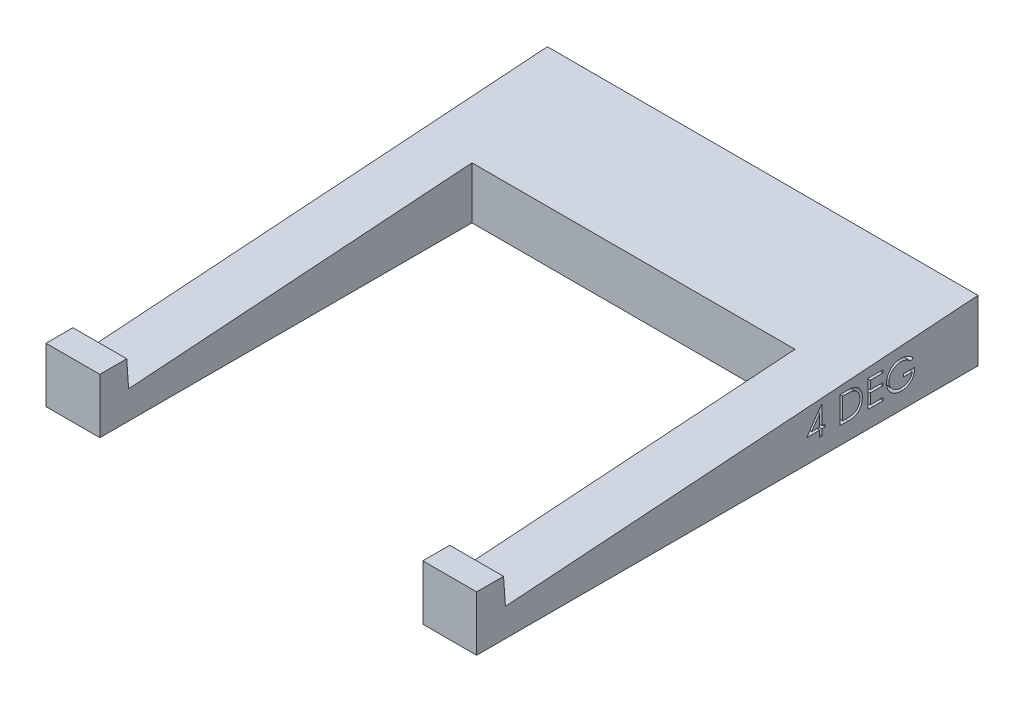
from build123d import *

# Parameters (mm, degrees)
BOSS_EXTRUDE1_DEPTH = 50.8
SKETCH5_W           = 38.1
SKETCH5_H           = 43.900896756
CUT_EXTRUDE2_DEPTH  = 74.010756427
CUT_EXTRUDE4_DEPTH  = 2.54


with BuildPart() as part:
    # Sketch1 → Boss-Extrude1 (new body)
    with BuildSketch(Plane(origin=(0, 0, 0), x_dir=(0, 0, -1), z_dir=(1, 0, 0))):
        Polygon((11.9888, 15.748), (11.9888, 22.947991753), (6.921174625, 22.593628866), (-43.755079129, 19.05), (-43.977096756, 22.225), (-47.152096756, 22.225), (-47.152096756, 15.748), align=None)
    extrude(amount=BOSS_EXTRUDE1_DEPTH)

    # Sketch5 → Cut-Extrude2 (cut, through all)
    with BuildSketch(Plane(origin=(0, 0, 0), x_dir=(1, 0, 0), z_dir=(0, 1, 0))):
        with Locations((25.4, -25.201648378)):
            Rectangle(SKETCH5_W, SKETCH5_H)
    extrude(amount=CUT_EXTRUDE2_DEPTH, mode=Mode.SUBTRACT)

    # Sketch7 → Cut-Extrude4 (cut)
    # profile 1 of 4: a face of its own
    with BuildSketch(Plane(origin=(50.8, 0, 0), x_dir=(0, 0, -1), z_dir=(1, 0, 0))):
        Polygon((-6.475936579, 21.036410256), (-6.418058974, 21.036410256), (-6.418058974, 18.838333333), (-6.051712821, 18.838333333), (-6.051712821, 18.512692308), (-6.418058974, 18.512692308), (-6.418058974, 17.78), (-6.702994872, 17.78), (-6.702994872, 18.512692308), (-8.209084615, 18.512692308), align=None)
        Polygon((-6.702994872, 18.838333333), (-6.702994872, 20.217219551), (-7.649389103, 18.838333333), align=None, mode=Mode.SUBTRACT)
    # profile 2 of 4: a face of its own
    with BuildSketch(Plane(origin=(50.8, 0, 0), x_dir=(0, 0, -1), z_dir=(1, 0, 0))):
        with BuildLine():
            Line((-4.260687179, 17.78), (-4.260687179, 20.955))
            Line((-4.260687179, 20.955), (-3.61958141, 20.955))
            add(Edge.make_bspline(
                [(-3.61958141, 20.955), (-3.563820257, 20.954598526), (-3.456089998, 20.95382288), (-3.300412992, 20.948904903), (-3.156373436, 20.940204981), (-3.024445057, 20.927532625), (-2.904265672, 20.911972373), (-2.796171792, 20.892468435), (-2.699604491, 20.869437737), (-2.640214355, 20.849802222), (-2.612129487, 20.840516827)],
                knots=[0, 0, 0, 0, 1.314313732, 2.53924729, 3.670748893, 4.714932338, 5.66265055, 6.526160246, 7.303039223, 8, 8, 8, 8], degree=3))
            add(Edge.make_bspline(
                [(-2.612129487, 20.840516827), (-2.575394974, 20.826518973), (-2.502758964, 20.798840689), (-2.399338217, 20.746628901), (-2.30197878, 20.687471302), (-2.210158556, 20.621289912), (-2.125974949, 20.546210824), (-2.046139214, 20.465423325), (-1.973917286, 20.375989617), (-1.907779046, 20.279764449), (-1.848147412, 20.177881373), (-1.796314033, 20.070534524), (-1.753266482, 19.958269057), (-1.717531198, 19.841397173), (-1.689367626, 19.719661887), (-1.670152588, 19.592921452), (-1.657478904, 19.461676758), (-1.656205229, 19.372618495), (-1.655558974, 19.327430889)],
                knots=[0, 0, 0, 0, 0.984719456, 1.947108742, 2.898477687, 3.838006223, 4.779231079, 5.722358779, 6.681677486, 7.655904652, 8.64651281, 9.637519902, 10.640069247, 11.656948941, 12.698408672, 13.768548281, 14.867775369, 16, 16, 16, 16], degree=3))
            add(Edge.make_bspline(
                [(-1.655558974, 19.327430889), (-1.656129538, 19.288186766), (-1.657253892, 19.210852122), (-1.667349772, 19.096877881), (-1.682024005, 18.986284855), (-1.70474267, 18.879599684), (-1.732322093, 18.775887658), (-1.767668145, 18.676254122), (-1.808158916, 18.579785095), (-1.855375592, 18.487784956), (-1.907210991, 18.400623612), (-1.962838572, 18.318458668), (-2.022199003, 18.242462574), (-2.085858327, 18.17240519), (-2.152993899, 18.10839213), (-2.224045256, 18.049888659), (-2.299195737, 17.998039498), (-2.37810875, 17.950807193), (-2.463086382, 17.909604442), (-2.555738203, 17.874742933), (-2.656459343, 17.845853503), (-2.765002575, 17.821749905), (-2.881555445, 17.802629781), (-3.006232221, 17.789815125), (-3.138841348, 17.78114925), (-3.229899681, 17.780390522), (-3.276767909, 17.78)],
                knots=[0, 0, 0, 0, 1.105936401, 2.179363191, 3.223086493, 4.248585256, 5.251745608, 6.245858792, 7.225916811, 8.198733463, 9.158002045, 10.082870192, 10.993790845, 11.873723703, 12.748670949, 13.606408763, 14.465103618, 15.319838547, 16.196477973, 17.123216899, 18.106603292, 19.147568657, 20.255746949, 21.433717677, 22.679120308, 24, 24, 24, 24], degree=3))
            Line((-3.276767909, 17.78), (-4.260687179, 17.78))
        make_face()
        with BuildLine():
            Line((-3.975751282, 18.105641026), (-3.611313181, 18.105641026))
            add(Edge.make_bspline(
                [(-3.611313181, 18.105641026), (-3.558945302, 18.105866084), (-3.458222692, 18.106298955), (-3.31339008, 18.110097347), (-3.181056628, 18.116303961), (-3.061203544, 18.124989925), (-2.953898501, 18.136482168), (-2.858917242, 18.149295473), (-2.776571115, 18.165258875), (-2.726742268, 18.179728674), (-2.703716026, 18.186415264)],
                knots=[0, 0, 0, 0, 1.375205317, 2.645023457, 3.804390687, 4.853969522, 5.800190428, 6.637939096, 7.370582563, 8, 8, 8, 8], degree=3))
            add(Edge.make_bspline(
                [(-2.703716026, 18.186415264), (-2.674734297, 18.196622035), (-2.617463068, 18.216791788), (-2.535020941, 18.253583381), (-2.45813423, 18.297164401), (-2.385462992, 18.345607892), (-2.318038098, 18.40062248), (-2.255060507, 18.461011877), (-2.196657015, 18.527083423), (-2.143431036, 18.598755112), (-2.095798503, 18.675580856), (-2.054549602, 18.756805369), (-2.01839857, 18.84153869), (-1.990024418, 18.931081998), (-1.967785281, 19.024634787), (-1.952033028, 19.122203637), (-1.942222528, 19.223770329), (-1.941078215, 19.292851184), (-1.940494872, 19.328066907)],
                knots=[0, 0, 0, 0, 0.998632004, 1.973411704, 2.929992603, 3.868527914, 4.809262121, 5.754881198, 6.702106254, 7.672490631, 8.653608572, 9.636854334, 10.631411391, 11.644891563, 12.686317036, 13.754757253, 14.855430412, 16, 16, 16, 16], degree=3))
            add(Edge.make_bspline(
                [(-1.940494872, 19.328066907), (-1.940960497, 19.365199421), (-1.941875221, 19.438146574), (-1.953372631, 19.545180991), (-1.970174328, 19.648124152), (-1.994470958, 19.746982944), (-2.025432541, 19.841950235), (-2.064071966, 19.93250079), (-2.108219542, 20.019590921), (-2.16074614, 20.101210525), (-2.218273143, 20.178402131), (-2.282115933, 20.249118376), (-2.351260211, 20.313520348), (-2.424951824, 20.37261101), (-2.505267622, 20.424013059), (-2.590315612, 20.46999312), (-2.681343471, 20.509014678), (-2.74467356, 20.529769075), (-2.776858053, 20.540316506)],
                knots=[0, 0, 0, 0, 1.122418816, 2.205001699, 3.251619955, 4.274784885, 5.280384055, 6.268708349, 7.249350384, 8.229342522, 9.199999885, 10.157847722, 11.105861043, 12.055065948, 13.010012805, 13.98527497, 14.976112212, 16, 16, 16, 16], degree=3))
            add(Edge.make_bspline(
                [(-2.776858053, 20.540316506), (-2.803483736, 20.547679266), (-2.860097243, 20.563334513), (-2.952480185, 20.580411815), (-3.056452499, 20.595474468), (-3.172475799, 20.608227118), (-3.30041783, 20.617377759), (-3.44037699, 20.624246023), (-3.592413774, 20.628878468), (-3.69780793, 20.629194796), (-3.752509095, 20.629358974)],
                knots=[0, 0, 0, 0, 0.674548936, 1.434276114, 2.292660221, 3.240891867, 4.284742987, 5.42552168, 6.663806718, 8, 8, 8, 8], degree=3))
            Line((-3.752509095, 20.629358974), (-3.975751282, 20.629358974))
            Line((-3.975751282, 20.629358974), (-3.975751282, 18.105641026))
        make_face(mode=Mode.SUBTRACT)
    # profile 3 of 4: a face of its own
    with BuildSketch(Plane(origin=(50.8, 0, 0), x_dir=(0, 0, -1), z_dir=(1, 0, 0))):
        Polygon((-1.004276923, 20.955), (0.786748718, 20.955), (0.786748718, 20.629358974), (-0.719341026, 20.629358974), (-0.719341026, 19.652435897), (0.786748718, 19.652435897), (0.786748718, 19.326794872), (-0.719341026, 19.326794872), (-0.719341026, 18.105641026), (0.786748718, 18.105641026), (0.786748718, 17.78), (-1.004276923, 17.78), align=None)
    # profile 4 of 4: a face of its own
    with BuildSketch(Plane(origin=(50.8, 0, 0), x_dir=(0, 0, -1), z_dir=(1, 0, 0))):
        with BuildLine():
            Line((4.328094872, 20.413112981), (4.083864103, 20.181602564))
            add(Edge.make_bspline(
                [(4.083864103, 20.181602564), (4.039669111, 20.223177704), (3.952332983, 20.305336601), (3.80994762, 20.411935861), (3.661390609, 20.503254395), (3.50743713, 20.577555052), (3.351899728, 20.636839342), (3.196842909, 20.679047012), (3.043857166, 20.705964242), (2.942105475, 20.70918312), (2.891967067, 20.710769231)],
                knots=[0, 0, 0, 0, 1.08915593, 2.152340314, 3.188132944, 4.216796309, 5.218260357, 6.173443236, 7.099959455, 8, 8, 8, 8], degree=3))
            add(Edge.make_bspline(
                [(2.891967067, 20.710769231), (2.86120159, 20.710394031), (2.799750426, 20.709644605), (2.708471948, 20.700079495), (2.618150784, 20.686322797), (2.528957437, 20.66641838), (2.440718484, 20.64119159), (2.353740818, 20.609636205), (2.267862189, 20.572846805), (2.18389153, 20.530335847), (2.102484073, 20.483636272), (2.025597515, 20.431885096), (1.952741789, 20.376740979), (1.88528626, 20.316823305), (1.822842912, 20.25267482), (1.76392546, 20.185488821), (1.710606056, 20.11342973), (1.662444785, 20.037823341), (1.619481031, 19.959997569), (1.58155461, 19.8807015), (1.549716537, 19.800198146), (1.524525674, 19.71838649), (1.503742438, 19.635899455), (1.489121466, 19.552165887), (1.480878511, 19.467096129), (1.479452682, 19.410130045), (1.478735897, 19.381492388)],
                knots=[0, 0, 0, 0, 1.02818874, 2.053710826, 3.065248034, 4.081641283, 5.106893873, 6.131558223, 7.173050175, 8.228653731, 9.27666206, 10.308777013, 11.325269123, 12.329503258, 13.32196095, 14.316845687, 15.314881793, 16.315733098, 17.311955233, 18.285320748, 19.252783886, 20.203351036, 21.145449891, 22.095197417, 23.042428769, 24, 24, 24, 24], degree=3))
            add(Edge.make_bspline(
                [(1.478735897, 19.381492388), (1.479421442, 19.352218146), (1.480790659, 19.293749602), (1.489553949, 19.206487836), (1.505817424, 19.120522078), (1.52755956, 19.035569843), (1.554756443, 18.95148564), (1.58865879, 18.868634006), (1.628814013, 18.787018008), (1.675292885, 18.707373027), (1.726261798, 18.629791427), (1.783360165, 18.556712433), (1.844012265, 18.487162899), (1.910427732, 18.422687027), (1.980476888, 18.361560207), (2.056252595, 18.305466555), (2.136264827, 18.253325596), (2.220635655, 18.205794467), (2.308449608, 18.163332438), (2.398489662, 18.125573618), (2.491043467, 18.094477362), (2.585624621, 18.069133511), (2.682120374, 18.04835967), (2.781020538, 18.034995206), (2.881597924, 18.025297095), (2.94939654, 18.024588008), (2.983553606, 18.024230769)],
                knots=[0, 0, 0, 0, 0.93586088, 1.869166235, 2.799637598, 3.729985548, 4.670839027, 5.622275134, 6.589130586, 7.576015415, 8.568469353, 9.55398029, 10.53834874, 11.515998671, 12.510579167, 13.508179873, 14.527009472, 15.561807829, 16.601455013, 17.643573243, 18.680854198, 19.719860599, 20.772568776, 21.833555941, 22.908541556, 24, 24, 24, 24], degree=3))
            add(Edge.make_bspline(
                [(2.983553606, 18.024230769), (3.024718249, 18.025091263), (3.105551715, 18.026780984), (3.224375131, 18.039934818), (3.338496488, 18.060478695), (3.447595115, 18.090564901), (3.551797727, 18.128940378), (3.651486323, 18.175200478), (3.745876042, 18.231119539), (3.835250635, 18.294232975), (3.917580368, 18.364550002), (3.991833752, 18.440427472), (4.056826446, 18.521497075), (4.113527137, 18.607281326), (4.160434274, 18.698490281), (4.198935952, 18.794676963), (4.228448295, 18.895884634), (4.240563165, 18.965817757), (4.246684615, 19.001153846)],
                knots=[0, 0, 0, 0, 1.13008108, 2.219097802, 3.278683437, 4.311054135, 5.322181354, 6.324827112, 7.324222904, 8.330512327, 9.32562643, 10.293043162, 11.24128371, 12.174520618, 13.111833804, 14.052305215, 15.015860969, 16, 16, 16, 16], degree=3))
            Line((4.246684615, 19.001153846), (3.188351282, 19.001153846))
            Line((3.188351282, 19.001153846), (3.188351282, 19.326794872))
            Line((3.188351282, 19.326794872), (4.531620513, 19.326794872))
            add(Edge.make_bspline(
                [(4.531620513, 19.326794872), (4.530073065, 19.266100221), (4.527044429, 19.147309826), (4.505800127, 18.974072509), (4.471495148, 18.810449616), (4.424631865, 18.656268829), (4.363966432, 18.511748642), (4.290149924, 18.37674232), (4.202000929, 18.252122045), (4.102659314, 18.136870449), (3.991171495, 18.034064664), (3.870549961, 17.943707849), (3.740595426, 17.867596191), (3.601430815, 17.805674018), (3.453511707, 17.757346894), (3.29649582, 17.723082678), (3.130596082, 17.702554069), (3.016897811, 17.699931175), (2.958748918, 17.698589744)],
                knots=[0, 0, 0, 0, 1.140356446, 2.231883559, 3.274166699, 4.278491846, 5.25512956, 6.21435461, 7.1637429, 8.11826594, 9.068280886, 10.0076534, 10.945064095, 11.891975133, 12.864533718, 13.863980011, 14.907571808, 16, 16, 16, 16], degree=3))
            add(Edge.make_bspline(
                [(2.958748918, 17.698589744), (2.922907581, 17.699106018), (2.852216913, 17.700124277), (2.747813, 17.707360871), (2.64628773, 17.718501108), (2.547655893, 17.735324184), (2.451554683, 17.75592962), (2.358464059, 17.78231543), (2.268029407, 17.81285775), (2.180110949, 17.847597396), (2.095506682, 17.887848828), (2.01383977, 17.932579715), (1.934658784, 17.981559407), (1.858503085, 18.03563496), (1.784975871, 18.094401906), (1.714551247, 18.157978032), (1.646834958, 18.226168976), (1.604416537, 18.274591364), (1.583042788, 18.298990385)],
                knots=[0, 0, 0, 0, 1.107784379, 2.184907829, 3.233506516, 4.263428166, 5.276301166, 6.270063455, 7.25232949, 8.225834625, 9.190232166, 10.146266622, 11.1027726, 12.066435141, 13.031522626, 14.010570082, 14.99756817, 16, 16, 16, 16], degree=3))
            add(Edge.make_bspline(
                [(1.583042788, 18.298990385), (1.552031264, 18.337698763), (1.490522976, 18.414473), (1.41134922, 18.537481521), (1.343856518, 18.664846065), (1.28909428, 18.796921192), (1.246333301, 18.933583364), (1.215666201, 19.07465795), (1.19769816, 19.220326615), (1.195109594, 19.318901533), (1.1938, 19.368772035)],
                knots=[0, 0, 0, 0, 1.023165419, 2.029347347, 3.013907458, 3.994755782, 4.975994455, 5.96558838, 6.970761222, 8, 8, 8, 8], degree=3))
            add(Edge.make_bspline(
                [(1.1938, 19.368772035), (1.194282816, 19.406115707), (1.195242312, 19.480328436), (1.206876887, 19.590507565), (1.223569602, 19.698730336), (1.248105144, 19.804908283), (1.279035327, 19.90911232), (1.317637418, 20.01139083), (1.362581717, 20.111804171), (1.414819988, 20.20966118), (1.472953748, 20.303663326), (1.536045734, 20.39343219), (1.604991857, 20.477332985), (1.678666189, 20.556428266), (1.757947744, 20.629724363), (1.842093793, 20.697899877), (1.931169183, 20.76104626), (2.025454146, 20.818168896), (2.123541403, 20.86948018), (2.225195832, 20.914464679), (2.330386404, 20.951642401), (2.438325045, 20.983187187), (2.549828778, 21.006514493), (2.664088443, 21.023431569), (2.781699616, 21.035007256), (2.861198014, 21.035938217), (2.901507332, 21.036410256)],
                knots=[0, 0, 0, 0, 1.008945113, 2.00506715, 2.99143336, 3.967273523, 4.948097931, 5.927297278, 6.919902385, 7.919676788, 8.923139349, 9.905703106, 10.883022732, 11.856032218, 12.825136022, 13.798837087, 14.781400844, 15.773989409, 16.776158564, 17.77167057, 18.775803737, 19.789618931, 20.80898985, 21.851988756, 22.910860228, 24, 24, 24, 24], degree=3))
            add(Edge.make_bspline(
                [(2.901507332, 21.036410256), (2.934380596, 21.035884575), (2.999564415, 21.034842209), (3.096561329, 21.027617136), (3.192058993, 21.016165472), (3.286199003, 21.000538316), (3.378660778, 20.979253397), (3.469707718, 20.953782381), (3.559471805, 20.924126228), (3.647671717, 20.888757774), (3.734900502, 20.848613415), (3.821643171, 20.803425524), (3.907603344, 20.752421413), (3.992930092, 20.695449634), (4.078161477, 20.633488677), (4.161949403, 20.564766415), (4.246316359, 20.491992915), (4.300565148, 20.439666934), (4.328094872, 20.413112981)],
                knots=[0, 0, 0, 0, 0.985871117, 1.954866573, 2.915460327, 3.869826059, 4.81536089, 5.759505086, 6.70452669, 7.649098992, 8.607881297, 9.583363685, 10.581137262, 11.603961102, 12.659522466, 13.73993555, 14.853081303, 16, 16, 16, 16], degree=3))
        make_face()
    extrude(amount=-CUT_EXTRUDE4_DEPTH, mode=Mode.SUBTRACT)


solid = part.part
